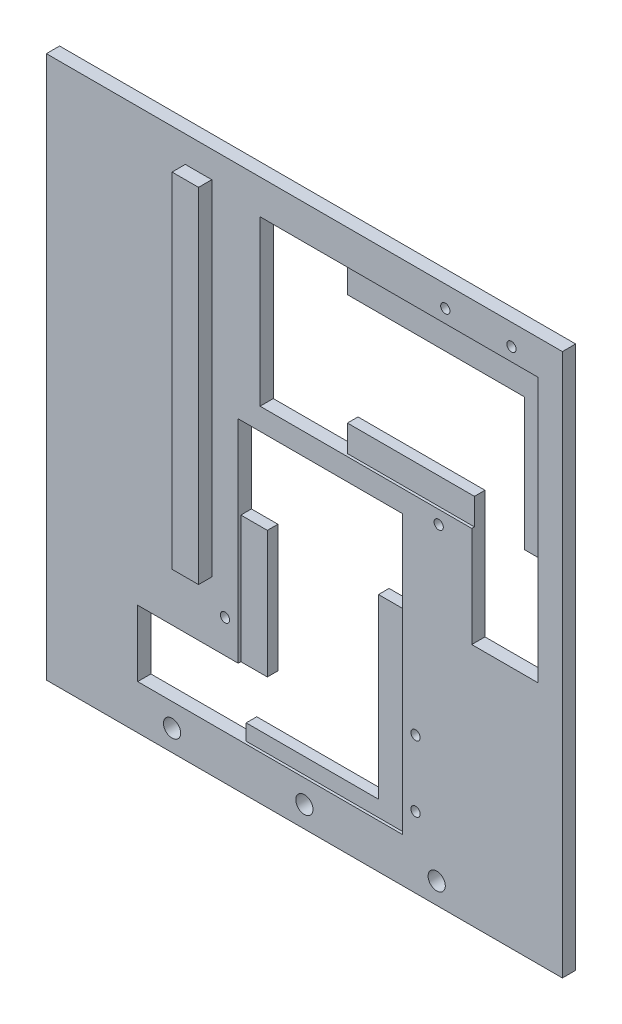
from build123d import *

# Parameters (mm, degrees)
SKETCH1_W            = 195
SKETCH1_H            = 205
BOSS_EXTRUDE1_DEPTH  = 5
CUT_EXTRUDE2_DEPTH   = 228.060014093
SKETCH6_W            = 10
SKETCH6_H            = 48
SKETCH6_W_2          = 48
SKETCH6_H_2          = 10
BOSS_EXTRUDE3_DEPTH  = 4
SKETCH11_R           = 1.75
RETAINER_HOLES_DEPTH = 228.060014093
SKETCH14_R           = 3.25
HANDLE_MOUNT_DEPTH   = 228.060014093
SKETCH12_W           = 10
SKETCH12_H           = 130
RIBS_DEPTH           = 5


with BuildPart() as part:
    # Sketch1 → Boss-Extrude1 (new body)
    with BuildSketch(Plane.XY):
        with Locations((0, -102.5)):
            Rectangle(SKETCH1_W, SKETCH1_H)
    extrude(amount=BOSS_EXTRUDE1_DEPTH)

    # Sketch5 → Cut-Extrude2 (cut, through all)
    with BuildSketch(Plane.XY.offset(5)):
        Polygon((-25, -83.25), (37, -83.25), (37, -188.25), (-63, -188.25), (-63, -163.25), (-25, -163.25), align=None)
        Polygon((88.25, -113), (63.25, -113), (63.25, -75), (-16.75, -75), (-16.75, -13), (88.25, -13), align=None)
    extrude(amount=-CUT_EXTRUDE2_DEPTH, mode=Mode.SUBTRACT)

    # Sketch6 → Boss-Extrude3 (add)
    with BuildSketch(Plane(origin=(0, 0, 0), x_dir=(-1, 0, 0), z_dir=(0, 0, -1))):
        with Locations((20, -139.25)):
            Rectangle(SKETCH6_W, SKETCH6_H)
        Polygon((23, -188.25), (23, -182.25), (-27, -182.25), (-27, -115.25), (-37, -115.25), (-37, -188.25), align=None)
        Polygon((-88.25, -73), (-82.25, -73), (-82.25, -23), (-15.25, -23), (-15.25, -13), (-88.25, -13), align=None)
        with Locations((-39.25, -70)):
            Rectangle(SKETCH6_W_2, SKETCH6_H_2)
    extrude(amount=-BOSS_EXTRUDE3_DEPTH)

    # Sketch11 → Retainer Holes (cut, through all)
    with BuildSketch(Plane.XY.offset(5)):
        with Locations((42, -153.25)):
            Circle(SKETCH11_R)
        with Locations((42, -178.25)):
            Circle(SKETCH11_R)
        with Locations((-30, -150.75)):
            Circle(SKETCH11_R)
        with Locations((50.75, -80)):
            Circle(SKETCH11_R)
        with Locations((53.25, -8)):
            Circle(SKETCH11_R)
        with Locations((78.25, -8)):
            Circle(SKETCH11_R)
    extrude(amount=-RETAINER_HOLES_DEPTH, mode=Mode.SUBTRACT)

    # Sketch14 → Handle Mount (cut, through all)
    with BuildSketch(Plane.XY.offset(5)):
        with Locations((-50, -197)):
            Circle(SKETCH14_R)
        with Locations((50, -197)):
            Circle(SKETCH14_R)
        with Locations((0, -197)):
            Circle(SKETCH14_R)
    extrude(amount=-HANDLE_MOUNT_DEPTH, mode=Mode.SUBTRACT)

    # Sketch12 → Ribs (add)
    with BuildSketch(Plane.XY.offset(5)):
        with Locations((-40, -75)):
            Rectangle(SKETCH12_W, SKETCH12_H)
    extrude(amount=RIBS_DEPTH)


solid = part.part
